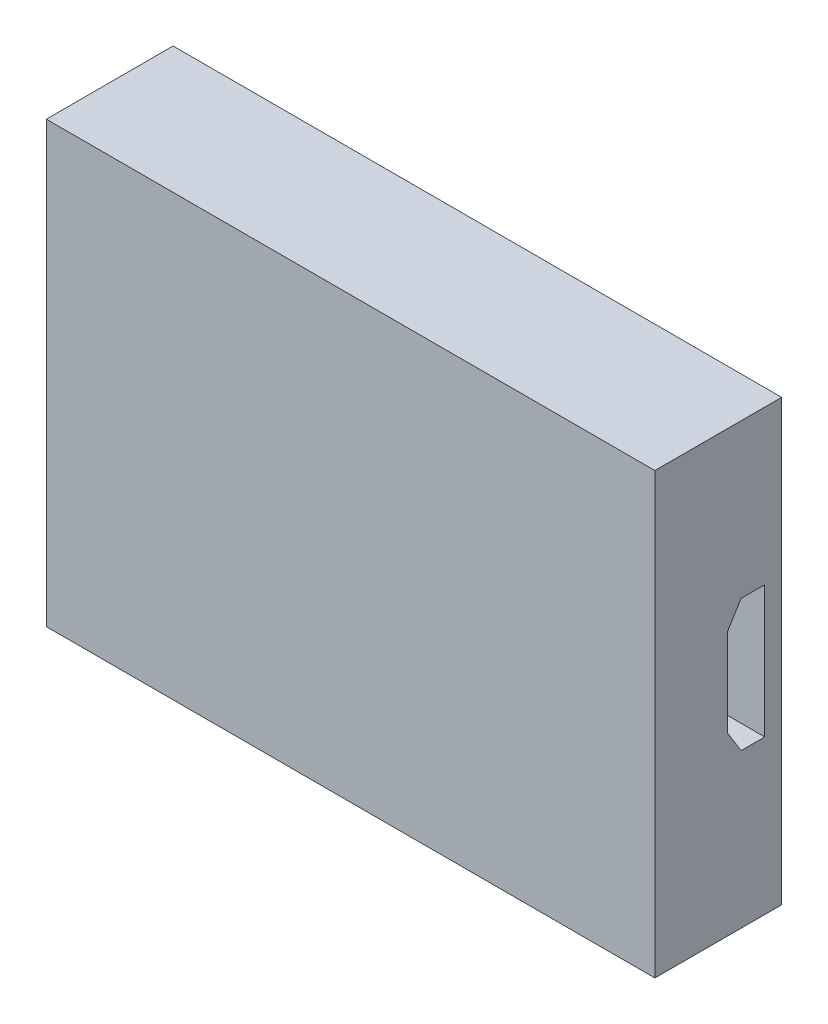
from build123d import *

# Parameters (mm, degrees)
SKETCH1_W           = 36
SKETCH1_H           = 26
SKETCH1_W_2         = 30
SKETCH1_H_2         = 20
EXTRUDE_THIN1_DEPTH = 5.5
CUT_EXTRUDE1_REACH  = 40.668
SKETCH1_4_W         = 36
SKETCH1_4_H         = 26
SKETCH1_4_W_2       = 30
SKETCH1_4_H_2       = 20
BOSS_EXTRUDE3_DEPTH = 2
SKETCH4_R           = 0.9
CUT_EXTRUDE4_DEPTH  = 5
CUT_EXTRUDE5_REACH  = 40.668
SKETCH5_R           = 0.5


with BuildPart() as part:
    # Sketch1 → Extrude-Thin1 (new body)
    with BuildSketch(Plane.XY):
        with Locations((-1.25, 0)):
            Rectangle(SKETCH1_W, SKETCH1_H)
        with Locations((-1.25, 0)):
            Rectangle(SKETCH1_W_2, SKETCH1_H_2, mode=Mode.SUBTRACT)
    extrude(amount=-EXTRUDE_THIN1_DEPTH)

    # Sketch2 → Cut-Extrude1 (cut, up to next)
    with BuildSketch(Plane(origin=(16.75, 0, 0), x_dir=(0, 0, -1), z_dir=(1, 0, 0)), mode=Mode.PRIVATE) as cut_extrude1_sk1:
        Polygon((4.5, -3.9), (4.5, 3.9), (3.1, 3.9), (2.3, 2.6), (2.3, 0), (2.3, -2.6), (3.1, -3.9), align=None)
    cut_extrude1_tool1 = extrude(cut_extrude1_sk1.sketch, amount=-CUT_EXTRUDE1_REACH, mode=Mode.PRIVATE) & part.part
    add(cut_extrude1_tool1.solids().sort_by_distance((16.75, 0, -3.453763))[0], mode=Mode.SUBTRACT)

    # Sketch1<4> → Boss-Extrude3 (add)
    # profile 1 of 2: a face of its own
    with BuildSketch(Plane.XY):
        with Locations((-1.25, 0)):
            Rectangle(SKETCH1_4_W, SKETCH1_4_H)
        with Locations((-1.25, 0)):
            Rectangle(SKETCH1_4_W_2, SKETCH1_4_H_2, mode=Mode.SUBTRACT)
    # profile 2 of 2: a face of its own
    with BuildSketch(Plane.XY):
        with Locations((-1.25, 0)):
            Rectangle(SKETCH1_4_W_2, SKETCH1_4_H_2)
    extrude(amount=BOSS_EXTRUDE3_DEPTH)

    # Sketch4 → Cut-Extrude4 (cut)
    with BuildSketch(Plane(origin=(0, 0, -5.5), x_dir=(-1, 0, 0), z_dir=(0, 0, -1))):
        with Locations((-14.75, 11)):
            Circle(SKETCH4_R)
        with Locations((17.25, 11)):
            Circle(SKETCH4_R)
        with Locations((17.25, -11)):
            Circle(SKETCH4_R)
        with Locations((-14.75, -11)):
            Circle(SKETCH4_R)
    extrude(amount=-CUT_EXTRUDE4_DEPTH, mode=Mode.SUBTRACT)

    # Sketch5 → Cut-Extrude5 (cut, up to next)
    with BuildSketch(Plane.ZY.offset(19.25), mode=Mode.PRIVATE) as cut_extrude5_sk1:
        with Locations(Location((-2.5, 4.2, 0), (0, 0, 270))):
            Circle(SKETCH5_R)
    cut_extrude5_tool1 = extrude(cut_extrude5_sk1.sketch, amount=-CUT_EXTRUDE5_REACH, mode=Mode.PRIVATE) & part.part
    # Sketch5 → Cut-Extrude5 (cut, up to next)
    with BuildSketch(Plane.ZY.offset(19.25), mode=Mode.PRIVATE) as cut_extrude5_sk2:
        with Locations(Location((-2.5, -4.2, 0), (0, 0, 270))):
            Circle(SKETCH5_R)
    cut_extrude5_tool2 = extrude(cut_extrude5_sk2.sketch, amount=-CUT_EXTRUDE5_REACH, mode=Mode.PRIVATE) & part.part
    add(cut_extrude5_tool1.solids().sort_by_distance((-19.25, 4.2, -2.5))[0], mode=Mode.SUBTRACT)
    add(cut_extrude5_tool2.solids().sort_by_distance((-19.25, -4.2, -2.5))[0], mode=Mode.SUBTRACT)


solid = part.part
